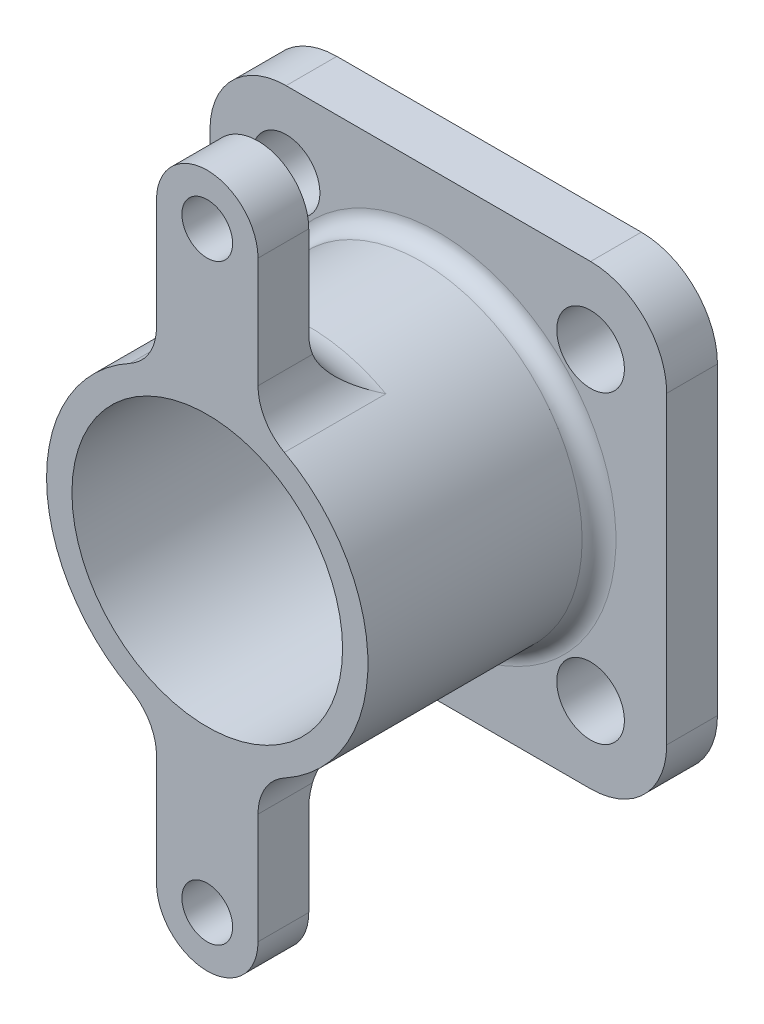
from build123d import *

# Parameters (mm, degrees)
SKETCH1_R           = 8
SKETCH1_R_2         = 2
BOSS_EXTRUDE1_DEPTH = 3
SKETCH2_R           = 9.5
SKETCH2_R_2         = 8
BOSS_EXTRUDE2_DEPTH = 16.66
BOSS_EXTRUDE3_START = -3
SKETCH3_R           = 1.5
BOSS_EXTRUDE3_DEPTH = 3
FILLET1_R           = 3
FILLET2_R           = 1


with BuildPart() as part:
    # Sketch1 → Boss-Extrude1 (new body)
    with BuildSketch(Plane.XY):
        with BuildLine():
            Line((-16, -13.5), (2, -13.5))
            ThreePointArc((2, -13.5), (5.181980515, -12.181980515), (6.5, -9))
            Line((6.5, -9), (6.5, 9))
            ThreePointArc((6.5, 9), (5.181980515, 12.181980515), (2, 13.5))
            Line((2, 13.5), (-16, 13.5))
            ThreePointArc((-16, 13.5), (-19.181980515, 12.181980515), (-20.5, 9))
            Line((-20.5, 9), (-20.5, -9))
            ThreePointArc((-20.5, -9), (-19.181980515, -12.181980515), (-16, -13.5))
        make_face()
        with Locations((-7, 0)):
            Circle(SKETCH1_R, mode=Mode.SUBTRACT)
        with Locations((-16, 9)):
            Circle(SKETCH1_R_2, mode=Mode.SUBTRACT)
        with Locations((2, 9)):
            Circle(SKETCH1_R_2, mode=Mode.SUBTRACT)
        with Locations((2, -9)):
            Circle(SKETCH1_R_2, mode=Mode.SUBTRACT)
        with Locations((-16, -9)):
            Circle(SKETCH1_R_2, mode=Mode.SUBTRACT)
    extrude(amount=BOSS_EXTRUDE1_DEPTH)

    # Sketch2 → Boss-Extrude2 (add)
    with BuildSketch(Plane.XY):
        with Locations(Location((-7, 0, 0), (0, 0, 180))):
            Circle(SKETCH2_R)
        with Locations((-7, 0)):
            Circle(SKETCH2_R_2, mode=Mode.SUBTRACT)
    extrude(amount=BOSS_EXTRUDE2_DEPTH)

    # Sketch3 → Boss-Extrude3 (add)
    # profile 1 of 2: a face of its own
    with BuildSketch(Plane.XY.offset(16.66).offset(BOSS_EXTRUDE3_START)):
        with BuildLine():
            Line((-4, 9.013878189), (-4, 17.5))
            ThreePointArc((-4, 17.5), (-7, 20.5), (-10, 17.5))
            Line((-10, 17.5), (-10, 9.013878189))
            ThreePointArc((-10, 9.013878189), (-7, 9.5), (-4, 9.013878189))
        make_face()
        with Locations((-7, 17.5)):
            Circle(SKETCH3_R, mode=Mode.SUBTRACT)
    # profile 2 of 2: a face of its own
    with BuildSketch(Plane.XY.offset(16.66).offset(BOSS_EXTRUDE3_START)):
        with BuildLine():
            Line((-10, -9.013878189), (-10, -17.5))
            ThreePointArc((-10, -17.5), (-7, -20.5), (-4, -17.5))
            Line((-4, -17.5), (-4, -9.013878189))
            ThreePointArc((-4, -9.013878189), (-7, -9.5), (-10, -9.013878189))
        make_face()
        with Locations((-7, -17.5)):
            Circle(SKETCH3_R, mode=Mode.SUBTRACT)
    extrude(amount=BOSS_EXTRUDE3_DEPTH)

    # Fillet1
    fillet1_edges = [part.edges().sort_by_distance(p)[0] for p in [
        (-10, -9.013878189, 15.16),
        (-4, -9.013878189, 15.16),
        (-7, -9.5, 13.66),
        (-4, 9.013878189, 15.16),
        (-10, 9.013878189, 15.16),
        (-7, 9.5, 13.66),
    ]]
    fillet(fillet1_edges, radius=FILLET1_R)

    # Fillet2
    fillet2_edges = [part.edges().sort_by_distance(p)[0] for p in [
        (2.5, 0, 3),
    ]]
    fillet(fillet2_edges, radius=FILLET2_R)


solid = part.part
